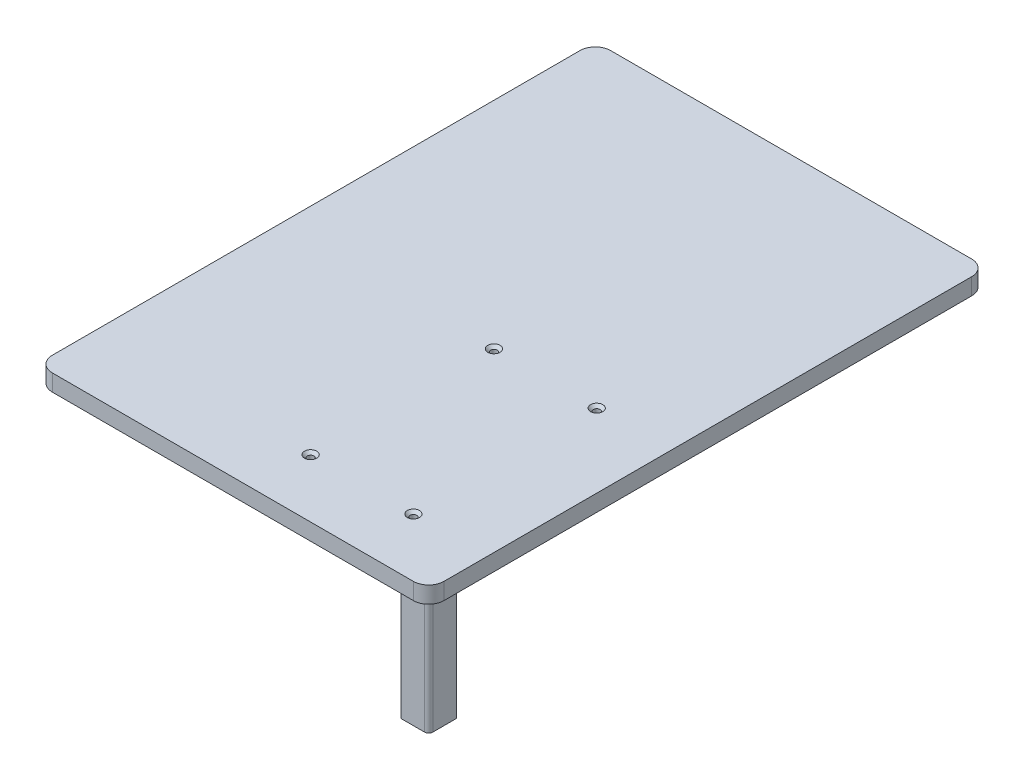
from build123d import *

# Parameters (mm, degrees)
SALIENTE_EXTRUIR1_DEPTH                              = 3
SALIENTE_EXTRUIR2_START                              = -3
SALIENTE_EXTRUIR2_DEPTH                              = 3
SALIENTE_EXTRUIR4_DEPTH                              = 3
SALIENTE_EXTRUIR5_DEPTH                              = 50
AVELLANADO_PARA_TORNILLO_CON_CABEZA_PLAN_D           = 2.4
AVELLANADO_PARA_TORNILLO_CON_CABEZA_PLAN_CSINK_D     = 4.4
AVELLANADO_PARA_TORNILLO_CON_CABEZA_PLAN_CSINK_ANGLE = 90
CROQUIS11_R                                          = 2
CORTAR_EXTRUIR2_DEPTH                                = 6
CHAFL_N2_SIZE                                        = 0.3


with BuildPart() as part:
    # Croquis1 → Saliente-Extruir1 (new body)
    with BuildSketch(Plane(origin=(0, 81, 0), x_dir=(1, 0, 0), z_dir=(0, 1, 0))):
        with BuildLine():
            Line((164.5, -35), (164.5, -58))
            Line((164.5, -58), (164.5, -95))
            ThreePointArc((164.5, -95), (162.889087297, -98.889087297), (159, -100.5))
            Line((159, -100.5), (29, -100.5))
            ThreePointArc((29, -100.5), (25.110912703, -98.889087297), (23.5, -95))
            Line((23.5, -95), (23.5, 95))
            ThreePointArc((23.5, 95), (25.110912703, 98.889087297), (29, 100.5))
            Line((29, 100.5), (159, 100.5))
            ThreePointArc((159, 100.5), (162.889087297, 98.889087297), (164.5, 95))
            Line((164.5, 95), (164.5, -35))
        make_face()
    extrude(amount=SALIENTE_EXTRUIR1_DEPTH)

    # Croquis2 → Saliente-Extruir2 (add)
    with BuildSketch(Plane(origin=(0, 81, 0), x_dir=(1, 0, 0), z_dir=(0, 1, 0)).offset(SALIENTE_EXTRUIR2_START)):
        with BuildLine():
            Line((164.5, -95), (164.5, 95))
            ThreePointArc((164.5, 95), (162.889087297, 98.889087297), (159, 100.5))
            Line((159, 100.5), (29, 100.5))
            ThreePointArc((29, 100.5), (25.110912703, 98.889087297), (23.5, 95))
            Line((23.5, 95), (23.5, -95))
            ThreePointArc((23.5, -95), (25.110912703, -98.889087297), (29, -100.5))
            Line((29, -100.5), (159, -100.5))
            ThreePointArc((159, -100.5), (162.889087297, -98.889087297), (164.5, -95))
        make_face()
        with BuildLine():
            Line((162.5, -95), (162.5, 95))
            ThreePointArc((162.5, 95), (161.474873734, 97.474873734), (159, 98.5))
            Line((159, 98.5), (29, 98.5))
            ThreePointArc((29, 98.5), (26.525126266, 97.474873734), (25.5, 95))
            Line((25.5, 95), (25.5, -95))
            ThreePointArc((25.5, -95), (26.525126266, -97.474873734), (29, -98.5))
            Line((29, -98.5), (159, -98.5))
            ThreePointArc((159, -98.5), (161.474873734, -97.474873734), (162.5, -95))
        make_face(mode=Mode.SUBTRACT)
    extrude(amount=SALIENTE_EXTRUIR2_DEPTH)

    # Croquis4 → Saliente-Extruir4 (add)
    with BuildSketch(Plane.XZ.offset(-81)):
        with BuildLine():
            Line((33, -92.5), (155, -92.5))
            ThreePointArc((155, -92.5), (156.060660172, -92.060660172), (156.5, -91))
            Line((156.5, -91), (156.5, 35))
            Line((156.5, 35), (156.5, 58))
            Line((156.5, 58), (156.5, 91))
            ThreePointArc((156.5, 91), (156.060660172, 92.060660172), (155, 92.5))
            Line((155, 92.5), (33, 92.5))
            ThreePointArc((33, 92.5), (31.939339828, 92.060660172), (31.5, 91))
            Line((31.5, 91), (31.5, -91))
            ThreePointArc((31.5, -91), (31.939339828, -92.060660172), (33, -92.5))
        make_face()
        Polygon((33.5, -90.5), (154.5, -90.5), (154.5, 35), (154.5, 58), (154.5, 90.5), (33.5, 90.5), align=None, mode=Mode.SUBTRACT)
    extrude(amount=SALIENTE_EXTRUIR4_DEPTH)

    # Croquis5 → Saliente-Extruir5 (add)
    with BuildSketch(Plane.XZ.offset(-81)):
        with BuildLine():
            Line((155, 92.5), (146.5, 92.5))
            Line((146.5, 92.5), (146.5, 82.5))
            Line((146.5, 82.5), (156.5, 82.5))
            Line((156.5, 82.5), (156.5, 91))
            ThreePointArc((156.5, 91), (156.060660172, 92.060660172), (155, 92.5))
        make_face()
        with BuildLine():
            Line((31.5, -91), (31.5, -82.5))
            Line((31.5, -82.5), (41.5, -82.5))
            Line((41.5, -82.5), (41.5, -92.5))
            Line((41.5, -92.5), (33, -92.5))
            ThreePointArc((33, -92.5), (31.939339828, -92.060660172), (31.5, -91))
        make_face()
    extrude(amount=SALIENTE_EXTRUIR5_DEPTH)

    # Avellanado para tornillo con cabeza plana de M21 (through all)
    with Locations(Plane(origin=(0, 84, 0), x_dir=(1, 0, 0), z_dir=(0, 1, 0))):
        with Locations((138, -13.5), (101, -13.5), (138, -79.5), (101, -79.5)):
            CounterSinkHole(AVELLANADO_PARA_TORNILLO_CON_CABEZA_PLAN_D / 2, AVELLANADO_PARA_TORNILLO_CON_CABEZA_PLAN_CSINK_D / 2, counter_sink_angle=AVELLANADO_PARA_TORNILLO_CON_CABEZA_PLAN_CSINK_ANGLE)

    # Croquis11 → Cortar-Extruir2 (cut)
    with BuildSketch(Plane.XZ.offset(-31)):
        with Locations(Location((36.5, -87.5, 0), (0, 0, 270))):
            Circle(CROQUIS11_R)
        with Locations(Location((151.5, 87.5, 0), (0, 0, 270))):
            Circle(CROQUIS11_R)
    extrude(amount=-CORTAR_EXTRUIR2_DEPTH, mode=Mode.SUBTRACT)

    # Chaflán2
    chafl_n2_edges = [part.edges().sort_by_distance(p)[0] for p in [
        (36.5, 31, -85.5),
        (151.5, 31, 89.5),
    ]]
    chamfer(chafl_n2_edges, length=CHAFL_N2_SIZE)


solid = part.part
